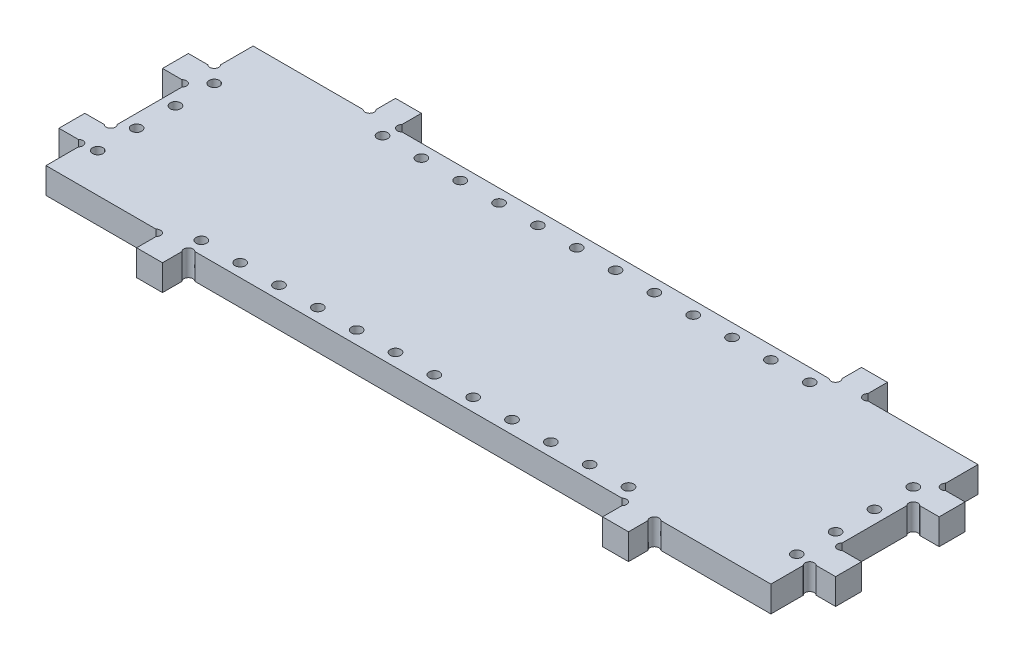
from build123d import *

# Parameters (mm, degrees)
SKETCH2_W                  = 355.6
SKETCH2_H                  = 101.6
RECTANGLE_EXTRUSION_DEPTH  = 12.7
SKETCH4_W                  = 12.7
SKETCH4_H                  = 12.7
FRONT_FACE_TABS_DEPTH      = 12.7
SKETCH6_R                  = 2.24536
TAB_CURVE_FRONT_BACK_DEPTH = 12.7
SKETCH7_W                  = 12.7
SKETCH7_H                  = 12.7
RIGHT_FACE_TABS_DEPTH      = 12.7
SKETCH8_R                  = 2.24536
TAB_CURVE_LEFT_RIGHT_DEPTH = 12.7
SKETCH9_R                  = 2.5527
CUT_EXTRUDE1_DEPTH         = 202.205839875


with BuildPart() as part:
    # Sketch2 → Rectangle Extrusion (new body)
    with BuildSketch(Plane(origin=(0, 0, 0), x_dir=(1, 0, 0), z_dir=(0, 1, 0))):
        Rectangle(SKETCH2_W, SKETCH2_H)
    extrude(amount=RECTANGLE_EXTRUSION_DEPTH)

    # Sketch4 → Front Face Tabs (add)
    with BuildSketch(Plane.XY.offset(50.8)):
        with Locations((-114.3, 6.35)):
            Rectangle(SKETCH4_W, SKETCH4_H)
        with Locations((114.3, 6.35)):
            Rectangle(SKETCH4_W, SKETCH4_H)
    front_face_tabs = extrude(amount=FRONT_FACE_TABS_DEPTH)

    # Mirror Rear Face Tabs: Front Face Tabs across plane
    add(front_face_tabs.mirror(Plane.XY))

    # Sketch6 → Tab Curve Front Back (cut)
    with BuildSketch(Plane(origin=(0, 12.7, 0), x_dir=(1, 0, 0), z_dir=(0, 1, 0))):
        with Locations((-122.2375, 52.3875)):
            Circle(SKETCH6_R)
        with Locations((-106.3625, 52.3875)):
            Circle(SKETCH6_R)
        with Locations((106.3625, 52.3875)):
            Circle(SKETCH6_R)
        with Locations((122.2375, 52.3875)):
            Circle(SKETCH6_R)
        with Locations((122.2375, -52.3875)):
            Circle(SKETCH6_R)
        with Locations((106.3625, -52.3875)):
            Circle(SKETCH6_R)
        with Locations((-106.3625, -52.3875)):
            Circle(SKETCH6_R)
        with Locations((-122.2375, -52.3875)):
            Circle(SKETCH6_R)
    extrude(amount=-TAB_CURVE_FRONT_BACK_DEPTH, mode=Mode.SUBTRACT)

    # Sketch7 → Right Face Tabs (add)
    with BuildSketch(Plane(origin=(177.8, 0, 0), x_dir=(0, 0, -1), z_dir=(1, 0, 0))):
        with Locations((-25.4, 6.35)):
            Rectangle(SKETCH7_W, SKETCH7_H)
        with Locations((25.4, 6.35)):
            Rectangle(SKETCH7_W, SKETCH7_H)
    right_face_tabs = extrude(amount=RIGHT_FACE_TABS_DEPTH)

    # Mirror Left Face Tabs: Right Face Tabs across plane
    add(right_face_tabs.mirror(Plane(origin=(0, 0, 0), x_dir=(0, 0, 1), z_dir=(1, 0, 0))))

    # Sketch8 → Tab Curve Left Right (cut)
    with BuildSketch(Plane(origin=(0, 12.7, 0), x_dir=(1, 0, 0), z_dir=(0, 1, 0))):
        with Locations((179.3875, 33.3375)):
            Circle(SKETCH8_R)
        with Locations((179.3875, 17.4625)):
            Circle(SKETCH8_R)
        with Locations((179.3875, -17.4625)):
            Circle(SKETCH8_R)
        with Locations((179.3875, -33.3375)):
            Circle(SKETCH8_R)
        with Locations((-179.3875, -33.3375)):
            Circle(SKETCH8_R)
        with Locations((-179.3875, -17.4625)):
            Circle(SKETCH8_R)
        with Locations((-179.3875, 17.4625)):
            Circle(SKETCH8_R)
        with Locations((-179.3875, 33.3375)):
            Circle(SKETCH8_R)
    extrude(amount=-TAB_CURVE_LEFT_RIGHT_DEPTH, mode=Mode.SUBTRACT)

    # Sketch9 → Cut-Extrude1 (cut, through all)
    with BuildSketch(Plane.XZ):
        with Locations(Location((-107.95, 44.45, 0), (0, 0, 270))):
            Circle(SKETCH9_R)
        with Locations(Location((-88.9, 44.45, 0), (0, 0, 270))):
            Circle(SKETCH9_R)
        with Locations(Location((-69.85, 44.45, 0), (0, 0, 270))):
            Circle(SKETCH9_R)
        with Locations(Location((-50.8, 44.45, 0), (0, 0, 270))):
            Circle(SKETCH9_R)
        with Locations(Location((-31.75, 44.45, 0), (0, 0, 270))):
            Circle(SKETCH9_R)
        with Locations(Location((-12.7, 44.45, 0), (0, 0, 270))):
            Circle(SKETCH9_R)
        with Locations(Location((6.35, 44.45, 0), (0, 0, 270))):
            Circle(SKETCH9_R)
        with Locations(Location((25.4, 44.45, 0), (0, 0, 270))):
            Circle(SKETCH9_R)
        with Locations(Location((44.45, 44.45, 0), (0, 0, 270))):
            Circle(SKETCH9_R)
        with Locations(Location((63.5, 44.45, 0), (0, 0, 270))):
            Circle(SKETCH9_R)
        with Locations(Location((82.55, 44.45, 0), (0, 0, 270))):
            Circle(SKETCH9_R)
        with Locations(Location((101.6, 44.45, 0), (0, 0, 270))):
            Circle(SKETCH9_R)
        with Locations(Location((101.6, -44.45, 0), (0, 0, 90))):
            Circle(SKETCH9_R)
        with Locations(Location((82.55, -44.45, 0), (0, 0, 90))):
            Circle(SKETCH9_R)
        with Locations(Location((63.5, -44.45, 0), (0, 0, 90))):
            Circle(SKETCH9_R)
        with Locations(Location((44.45, -44.45, 0), (0, 0, 90))):
            Circle(SKETCH9_R)
        with Locations(Location((25.4, -44.45, 0), (0, 0, 90))):
            Circle(SKETCH9_R)
        with Locations(Location((6.35, -44.45, 0), (0, 0, 90))):
            Circle(SKETCH9_R)
        with Locations(Location((-12.7, -44.45, 0), (0, 0, 90))):
            Circle(SKETCH9_R)
        with Locations(Location((-31.75, -44.45, 0), (0, 0, 90))):
            Circle(SKETCH9_R)
        with Locations(Location((-50.8, -44.45, 0), (0, 0, 90))):
            Circle(SKETCH9_R)
        with Locations(Location((-69.85, -44.45, 0), (0, 0, 90))):
            Circle(SKETCH9_R)
        with Locations(Location((-88.9, -44.45, 0), (0, 0, 90))):
            Circle(SKETCH9_R)
        with Locations(Location((-107.95, -44.45, 0), (0, 0, 90))):
            Circle(SKETCH9_R)
        with Locations(Location((171.45, -25.4, 0), (0, 0, 270))):
            Circle(SKETCH9_R)
        with Locations(Location((171.45, -6.35, 0), (0, 0, 270))):
            Circle(SKETCH9_R)
        with Locations(Location((171.45, 12.7, 0), (0, 0, 270))):
            Circle(SKETCH9_R)
        with Locations(Location((171.45, 31.75, 0), (0, 0, 270))):
            Circle(SKETCH9_R)
        with Locations(Location((-171.45, -25.4, 0), (0, 0, 90))):
            Circle(SKETCH9_R)
        with Locations(Location((-171.45, -6.35, 0), (0, 0, 90))):
            Circle(SKETCH9_R)
        with Locations(Location((-171.45, 12.7, 0), (0, 0, 90))):
            Circle(SKETCH9_R)
        with Locations(Location((-171.45, 31.75, 0), (0, 0, 90))):
            Circle(SKETCH9_R)
    extrude(amount=-CUT_EXTRUDE1_DEPTH, mode=Mode.SUBTRACT)


solid = part.part
